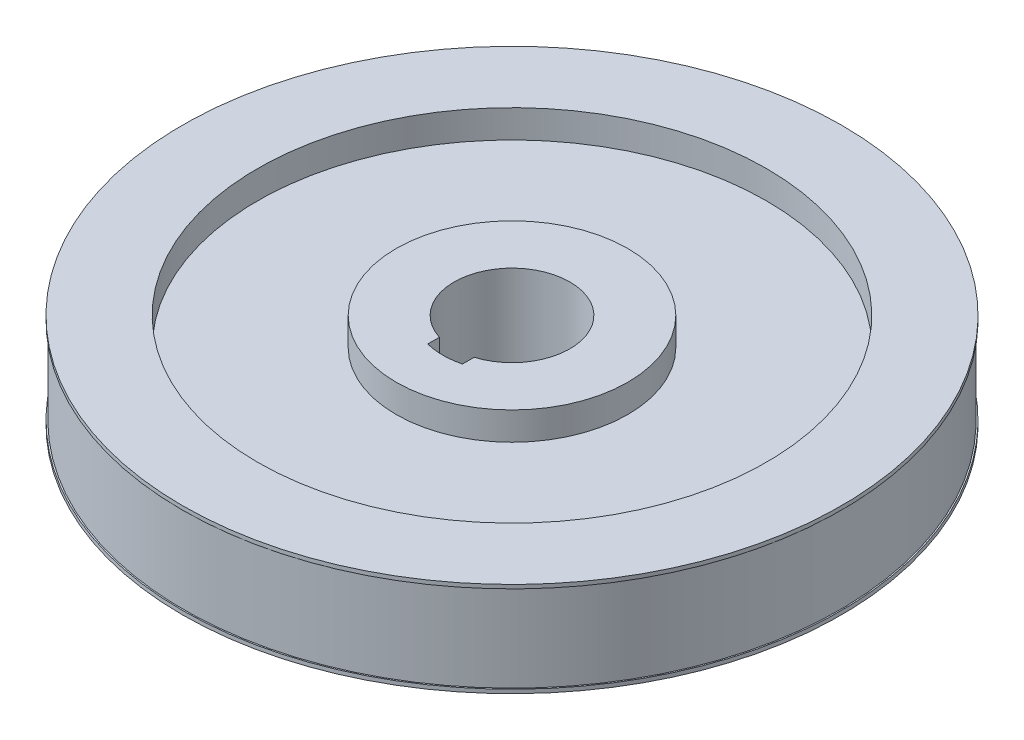
from build123d import *

# Parameters (mm, degrees)
SKETCH1_R           = 170
BOSS_EXTRUDE1_DEPTH = 22.5
SKETCH2_R           = 170.69
BOSS_EXTRUDE2_DEPTH = 2
CUT_EXTRUDE1_START  = -10
SKETCH3_R           = 131.78
SKETCH3_R_2         = 60
CUT_EXTRUDE1_DEPTH  = 233.632236523
SKETCH4_R           = 30
CUT_EXTRUDE2_DEPTH  = 247.315148133
CUT_EXTRUDE3_DEPTH  = 247.315148133


with BuildPart() as part:
    # Sketch1 → Boss-Extrude1 (new, symmetric)
    with BuildSketch(Plane(origin=(0, 0, 0), x_dir=(1, 0, 0), z_dir=(0, 1, 0))):
        with Locations(Location((0, 0, 0), (0, 0, 90))):
            Circle(SKETCH1_R)
    extrude(amount=BOSS_EXTRUDE1_DEPTH, both=True)

    # Sketch2 → Boss-Extrude2 (add)
    with BuildSketch(Plane(origin=(0, 22.5, 0), x_dir=(1, 0, 0), z_dir=(0, 1, 0))):
        with Locations(Location((0, 0, 0), (0, 0, 270))):
            Circle(SKETCH2_R)
    boss_extrude2 = extrude(amount=BOSS_EXTRUDE2_DEPTH)

    # Mirror1: Boss-Extrude2 across plane
    add(boss_extrude2.mirror(Plane.ZX))

    # Sketch3 → Cut-Extrude1 (cut, through all)
    with BuildSketch(Plane(origin=(0, 0, 0), x_dir=(1, 0, 0), z_dir=(0, 1, 0)).offset(CUT_EXTRUDE1_START)):
        with Locations(Location((0, 0, 0), (0, 0, 270))):
            Circle(SKETCH3_R)
        with Locations(Location((0, 0, 0), (0, 0, 270))):
            Circle(SKETCH3_R_2, mode=Mode.SUBTRACT)
    cut_extrude1 = extrude(amount=-CUT_EXTRUDE1_DEPTH, mode=Mode.SUBTRACT)

    # Mirror3: Cut-Extrude1 across plane
    add(cut_extrude1.mirror(Plane.ZX), mode=Mode.SUBTRACT)

    # Sketch4 → Cut-Extrude2 (cut, through all)
    with BuildSketch(Plane.XZ.offset(24.5)):
        with Locations(Location((0, 0, 0), (0, 0, 270))):
            Circle(SKETCH4_R)
    extrude(amount=-CUT_EXTRUDE2_DEPTH, mode=Mode.SUBTRACT)

    # Sketch5 → Cut-Extrude3 (cut, through all)
    with BuildSketch(Plane.XZ.offset(24.5)):
        with BuildLine():
            Line((-9, 34.650252524), (-9, 18.069809638))
            Line((-9, 18.069809638), (9, 18.069809638))
            Line((9, 18.069809638), (9, 34.650252524))
            ThreePointArc((9, 34.650252524), (0, 35.8), (-9, 34.650252524))
        make_face()
    extrude(amount=-CUT_EXTRUDE3_DEPTH, mode=Mode.SUBTRACT)


solid = part.part
